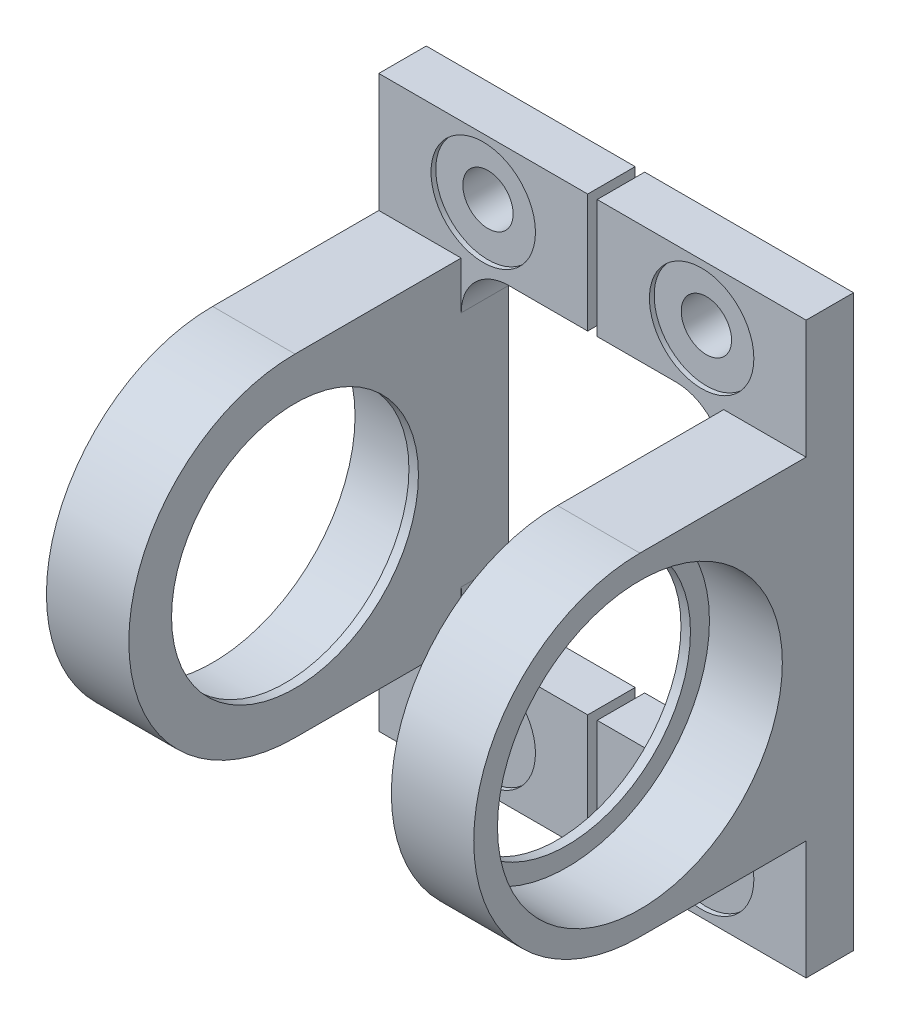
from build123d import *

# Parameters (mm, degrees)
EXTRUDE_2_DEPTH          = 5
SKETCH_4_W               = 8.676470589
SKETCH_4_H               = 35
SKETCH_4_W_2             = 8.676470588
EXTRUDE_15_DEPTH         = 35
CUT_EXTRUDE_1_DEPTH      = 45
SKETCH_6_R               = 15
CUT_EXTRUDE_2_DEPTH      = 45
FILLET_1_R               = 5
EXTRUDE_START            = -1
SKETCH_7_R               = 15
SKETCH_7_R_2             = 13
EXTRUDE_16_DEPTH         = 1
SKETCH_8_R               = 15
SKETCH_8_R_2             = 13
EXTRUDE_17_DEPTH         = 1
SKETCH_9_W               = 1
SKETCH_9_H               = 12.5
CUT_EXTRUDE_3_DEPTH      = 5
HOLE_WIZARD_1_AT_2_COUNT = 2
HOLE_WIZARD_1_AT_2_PITCH = 23
HOLE_WIZARD_1_AT_3_COUNT = 2
HOLE_WIZARD_1_AT_3_PITCH = 47.5
HOLE_WIZARD_1_AT_4_COUNT = 2
HOLE_WIZARD_1_AT_4_PITCH = 52.775467786


with BuildPart() as part:
    # 草图2 → 凸台-拉伸2 (new body)
    with BuildSketch(Plane.XY):
        Polygon((7.726423565, 24.338235294), (-14.773576435, 24.338235294), (-14.773576435, -35.661764706), (7.726423565, -35.661764706), (7.726423565, -23.161764706), (-6.097105846, -23.161764706), (-6.097105846, 11.838235294), (7.726423565, 11.838235294), align=None)
        Polygon((30.226423565, 24.338235294), (7.726423565, 24.338235294), (7.726423565, 11.838235294), (21.549952977, 11.838235294), (21.549952977, -23.161764706), (7.726423565, -23.161764706), (7.726423565, -35.661764706), (30.226423565, -35.661764706), align=None)
    extrude(amount=EXTRUDE_2_DEPTH)

    # 草图4 → 凸台-拉伸15 (add)
    with BuildSketch(Plane.XY.offset(5)):
        with Locations((-10.435341141, -5.661764706)):
            Rectangle(SKETCH_4_W, SKETCH_4_H)
        with Locations((25.888188271, -5.661764706)):
            Rectangle(SKETCH_4_W_2, SKETCH_4_H)
    extrude(amount=EXTRUDE_15_DEPTH)

    # 草图5 → 切除-拉伸1 (cut)
    with BuildSketch(Plane.ZY.offset(14.773576435)):
        with BuildLine():
            Line((40, -23.161764706), (40, -5.661764706))
            ThreePointArc((40, -5.661764706), (34.874368671, -18.036133377), (22.5, -23.161764706))
            Line((22.5, -23.161764706), (40, -23.161764706))
        make_face()
        with BuildLine():
            ThreePointArc((22.5, 11.838235294), (34.874368671, 6.712603965), (40, -5.661764706))
            Line((40, -5.661764706), (40, 11.838235294))
            Line((40, 11.838235294), (22.5, 11.838235294))
        make_face()
    extrude(amount=-CUT_EXTRUDE_1_DEPTH, mode=Mode.SUBTRACT)

    # 草图6 → 切除-拉伸2 (cut)
    with BuildSketch(Plane.ZY.offset(14.773576435)):
        with Locations((22.5, -5.661764706)):
            Circle(SKETCH_6_R)
    extrude(amount=-CUT_EXTRUDE_2_DEPTH, mode=Mode.SUBTRACT)

    # 圆角1
    fillet_1_edges = [part.edges().sort_by_distance(p)[0] for p in [
        (-6.097105846, 11.838235294, 2.5),
        (-6.097105846, -23.161764706, 2.5),
        (21.549952977, -23.161764706, 2.5),
        (21.549952977, 11.838235294, 2.5),
    ]]
    fillet(fillet_1_edges, radius=FILLET_1_R)

    # 草图7 → 凸台-拉伸16 (add)
    with BuildSketch(Plane(origin=(-6.097105846, 0, 0), x_dir=(0, 0, -1), z_dir=(1, 0, 0)).offset(EXTRUDE_START)):
        with Locations(Location((-22.5, -5.661764706, 0), (0, 0, 180))):
            Circle(SKETCH_7_R)
        with Locations((-22.5, -5.661764706)):
            Circle(SKETCH_7_R_2, mode=Mode.SUBTRACT)
    extrude(amount=EXTRUDE_16_DEPTH)

    # 草图8 → 凸台-拉伸17 (add)
    with BuildSketch(Plane.ZY.offset(-21.549952977)):
        with Locations((22.5, -5.661764706)):
            Circle(SKETCH_8_R)
        with Locations(Location((22.5, -5.661764706, 0), (0, 0, 180))):
            Circle(SKETCH_8_R_2, mode=Mode.SUBTRACT)
    extrude(amount=-EXTRUDE_17_DEPTH)

    # 草图9 → 切除-拉伸3 (cut)
    with BuildSketch(Plane.XY.offset(5)):
        with Locations((7.726423565, 18.088235294)):
            Rectangle(SKETCH_9_W, SKETCH_9_H)
        with Locations((7.726423565, -29.411764706)):
            Rectangle(SKETCH_9_W, SKETCH_9_H)
    extrude(amount=-CUT_EXTRUDE_3_DEPTH, mode=Mode.SUBTRACT)


with BuildPart() as cut_extrude_3_piece_1:
    # of the separate pieces the step leaves, piece 1, a body of its own (cut_extrude_3_pieces)
    add(part.part.solids().sort_by_distance((16.549952977, 11.838235294, 5))[0])


with BuildPart() as cut_extrude_3_piece_2:
    # of the separate pieces the step leaves, piece 2, a body of its own (cut_extrude_3_pieces)
    add(part.part.solids().sort_by_distance((7.226423565, 11.838235294, 5))[0])

    # 草图13 → 打孔尺寸(%根据六角头螺)栓 全螺纹的类型1 (revolve, cut)
    with BuildSketch(Plane(origin=(-3.773576435, 18.088235294, 5), x_dir=(0, -1, 0), z_dir=(1, 0, 0))):
        Polygon((0, 0), (0, 6.59228064), (2.65, 5), (2.65, 0.5), (5.5, 0.5), (5.5, 0), align=None)
    hole_wizard_1 = revolve(axis=Axis((-3.773576435, 18.088235294, 11.35), (0, 0, -1)), mode=Mode.SUBTRACT)

    # 打孔尺寸(%根据六角头螺)栓 全螺纹的类型1 at 3: 打孔尺寸(%根据六角头螺)栓 全螺纹的类型1 ×2
    with Locations(*[(0, -i * HOLE_WIZARD_1_AT_3_PITCH, 0) for i in range(1, HOLE_WIZARD_1_AT_3_COUNT)]):
        add(hole_wizard_1, mode=Mode.SUBTRACT)


with BuildPart() as cut_extrude_3_piece_1_1:
    add(cut_extrude_3_piece_1.part)

    # 打孔尺寸(%根据六角头螺)栓 全螺纹的类型1 at 2: 打孔尺寸(%根据六角头螺)栓 全螺纹的类型1 ×2
    with Locations(*[(i * HOLE_WIZARD_1_AT_2_PITCH, 0, 0) for i in range(1, HOLE_WIZARD_1_AT_2_COUNT)]):
        add(hole_wizard_1, mode=Mode.SUBTRACT)

    # 打孔尺寸(%根据六角头螺)栓 全螺纹的类型1 at 4: 打孔尺寸(%根据六角头螺)栓 全螺纹的类型1 ×2
    with Locations(*[Vector(0.43580854827079, -0.900039393167936, 0) * (i * HOLE_WIZARD_1_AT_4_PITCH) for i in range(1, HOLE_WIZARD_1_AT_4_COUNT)]):
        add(hole_wizard_1, mode=Mode.SUBTRACT)


solid = Compound([cut_extrude_3_piece_2.part, cut_extrude_3_piece_1_1.part])
